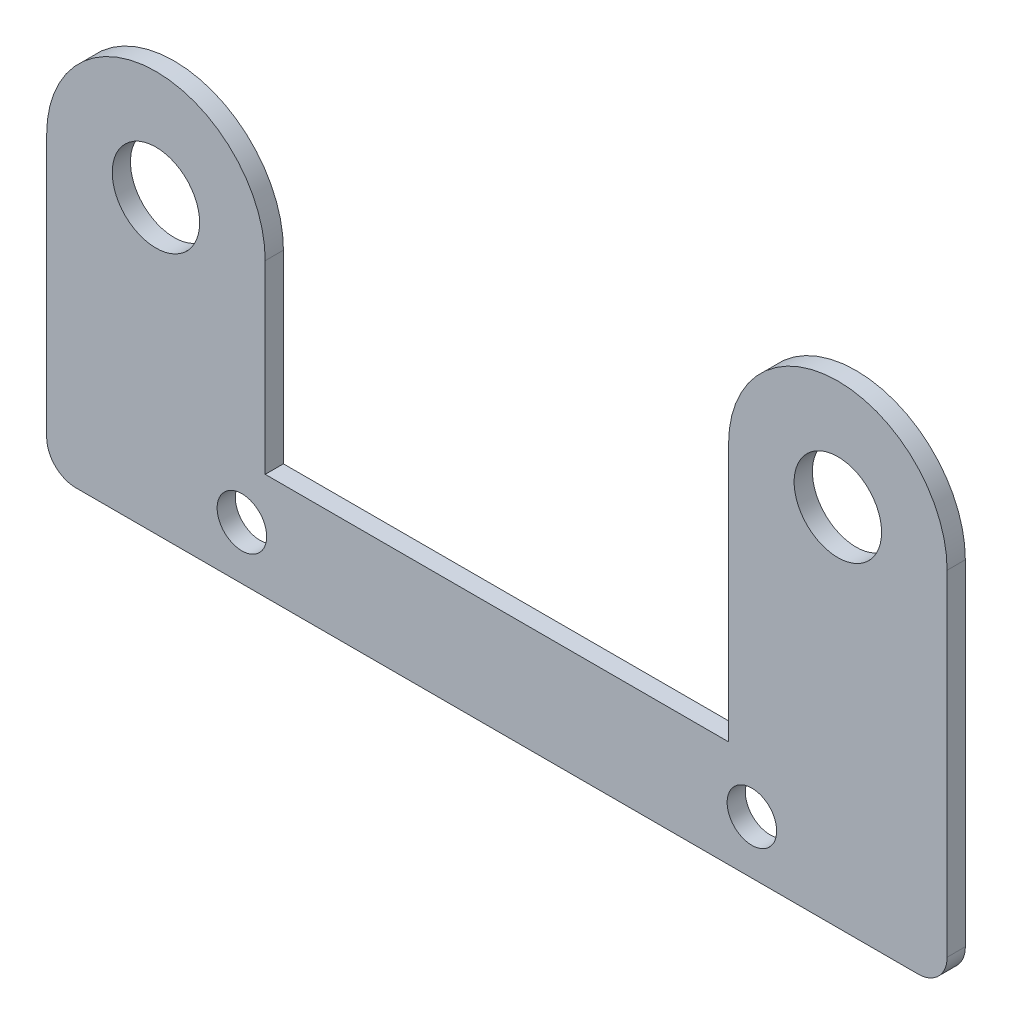
from build123d import *

# Parameters (mm, degrees)
SKETCH1_R           = 2.159
SKETCH1_R_2         = 3.81
BOSS_EXTRUDE1_DEPTH = 1.5875
FILLET1_R           = 2.54


with BuildPart() as part:
    # Sketch1 → Boss-Extrude1 (new body)
    with BuildSketch(Plane.XY):
        with BuildLine():
            Line((0, 25.4), (0, 0))
            Line((0, 0), (78.486, 0))
            Line((78.486, 0), (78.486, 31.75))
            ThreePointArc((78.486, 31.75), (68.961, 41.275), (59.436, 31.75))
            Line((59.436, 31.75), (59.436, 9.271))
            Line((59.436, 9.271), (19.05, 9.271))
            Line((19.05, 9.271), (19.05, 25.4))
            ThreePointArc((19.05, 25.4), (9.525, 34.925), (0, 25.4))
        make_face()
        with Locations((17.018, 4.6355)):
            Circle(SKETCH1_R, mode=Mode.SUBTRACT)
        with Locations((61.468, 4.6355)):
            Circle(SKETCH1_R, mode=Mode.SUBTRACT)
        with Locations((9.525, 25.4)):
            Circle(SKETCH1_R_2, mode=Mode.SUBTRACT)
        with Locations((68.961, 31.75)):
            Circle(SKETCH1_R_2, mode=Mode.SUBTRACT)
    extrude(amount=BOSS_EXTRUDE1_DEPTH)

    # Fillet1
    fillet1_edges = [part.edges().sort_by_distance(p)[0] for p in [
        (78.486, 0, 0.79375),
        (0, 0, 0.79375),
    ]]
    fillet(fillet1_edges, radius=FILLET1_R)


solid = part.part
